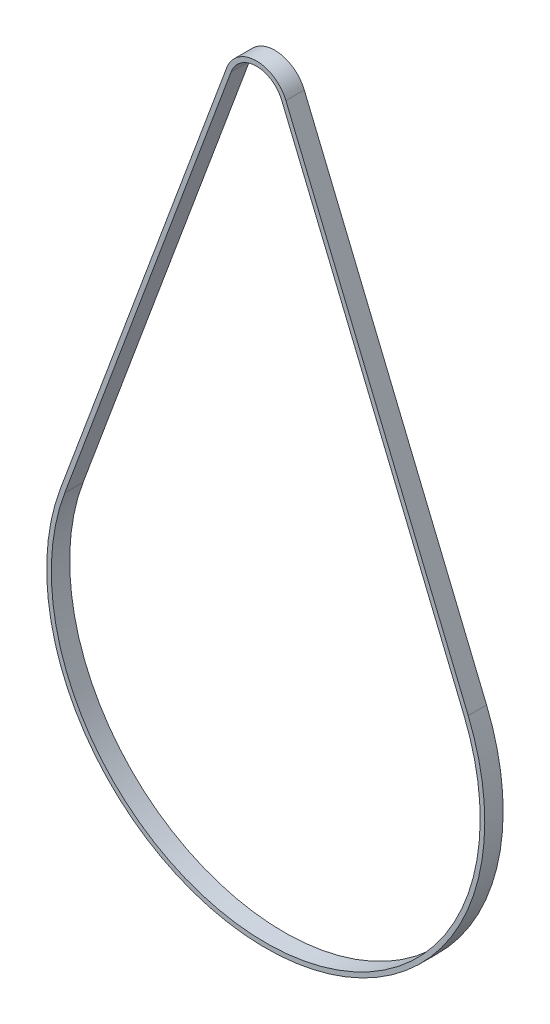
from build123d import *

# Parameters (mm, degrees)
EXTRUDE_THIN1_DEPTH = 6


with BuildPart() as part:
    # Sketch2 → Extrude-Thin1 (new body)
    with BuildSketch(Plane.XY):
        with BuildLine():
            Line((-9.172691079, 8.848445861), (50.331247545, -135.264665135))
            ThreePointArc((50.331247545, -135.264665135), (-14.476023559, -234.04079971), (-82.780013714, -137.649554888))
            Line((-82.780013714, -137.649554888), (-28.476616505, 8.502586814))
            ThreePointArc((-28.476616505, 8.502586814), (-18.942598025, 15.258506457), (-9.172691079, 8.848445861))
        make_face()
        with BuildLine():
            Line((-10.559154637, 8.275978568), (48.944783986, -135.837132427))
            ThreePointArc((48.944783986, -135.837132427), (-14.502894017, -232.541040403), (-81.37393333, -138.171989528))
            Line((-81.37393333, -138.171989528), (-27.070536121, 7.980152173))
            ThreePointArc((-27.070536121, 7.980152173), (-18.915727567, 13.758747151), (-10.559154637, 8.275978568))
        make_face(mode=Mode.SUBTRACT)
    extrude(amount=EXTRUDE_THIN1_DEPTH)


solid = part.part
